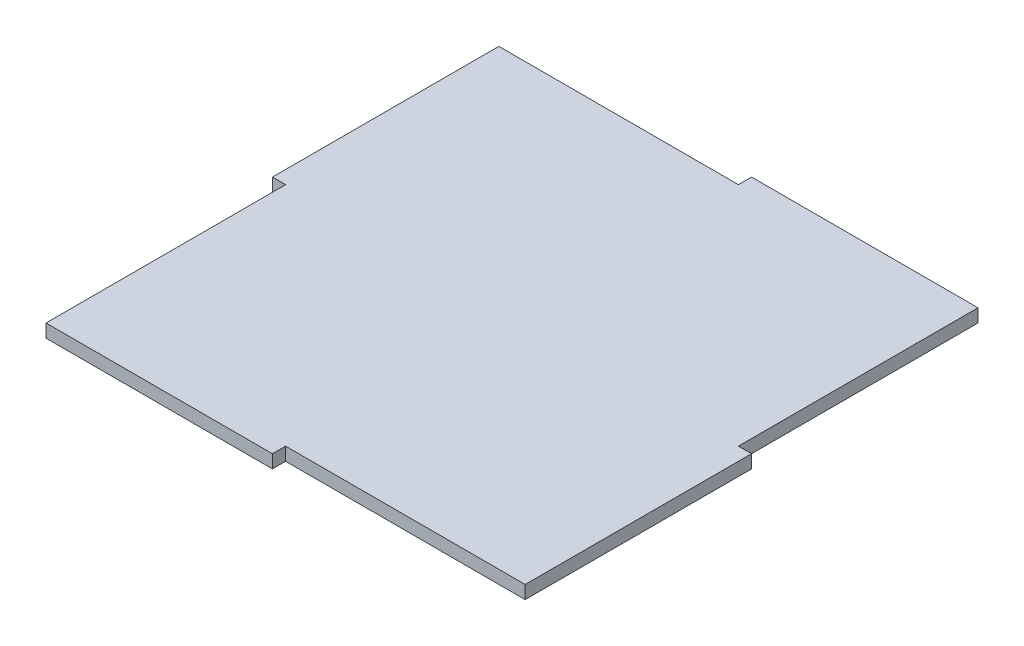
from build123d import *

# Parameters (mm, degrees)
P_IDAT_VYSUNUT_M1_DEPTH = 2.4


with BuildPart() as part:
    # Skica1 → Přidat vysunutím1 (new body)
    with BuildSketch(Plane(origin=(0, 0, 0), x_dir=(1, 0, 0), z_dir=(0, 1, 0))):
        Polygon((41.3, 87.4), (41.3, 85), (-2.4, 85), (-2.4, 43.7), (0, 43.7), (0, 0), (41.3, 0), (41.3, 2.4), (85, 2.4), (85, 43.7), (82.6, 43.7), (82.6, 87.4), align=None)
    extrude(amount=P_IDAT_VYSUNUT_M1_DEPTH)


solid = part.part
